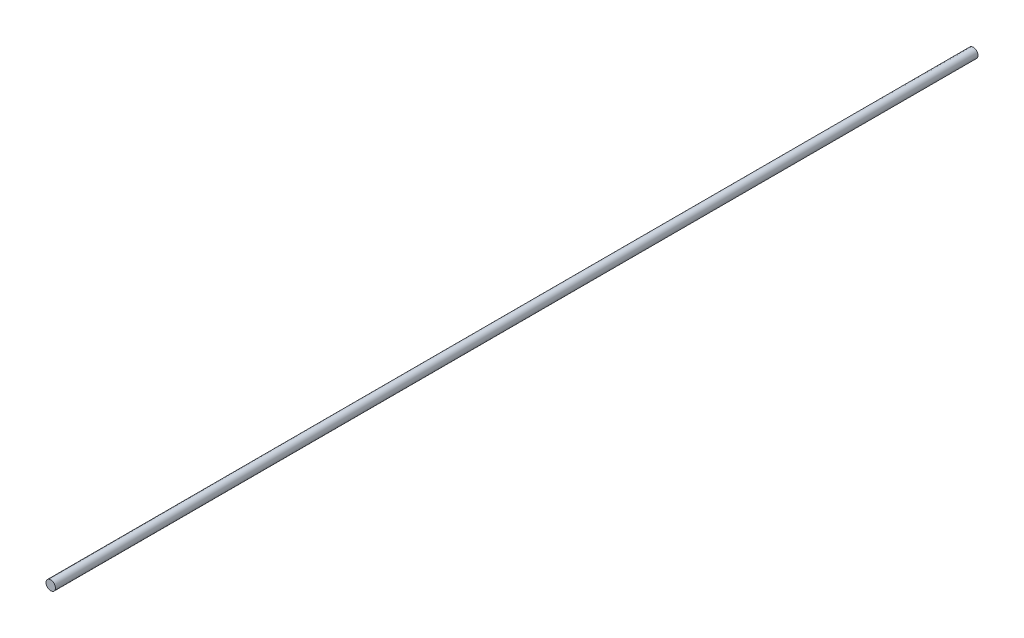
from build123d import *

# Parameters (mm, degrees)
SCHIZZO1_R                   = 1
ESTRUSIONE_ESTRUSIONE1_DEPTH = 195


with BuildPart() as part:
    # Schizzo1 → Estrusione-Estrusione1 (new body)
    with BuildSketch(Plane.XY):
        Circle(SCHIZZO1_R)
    extrude(amount=ESTRUSIONE_ESTRUSIONE1_DEPTH)


solid = part.part
